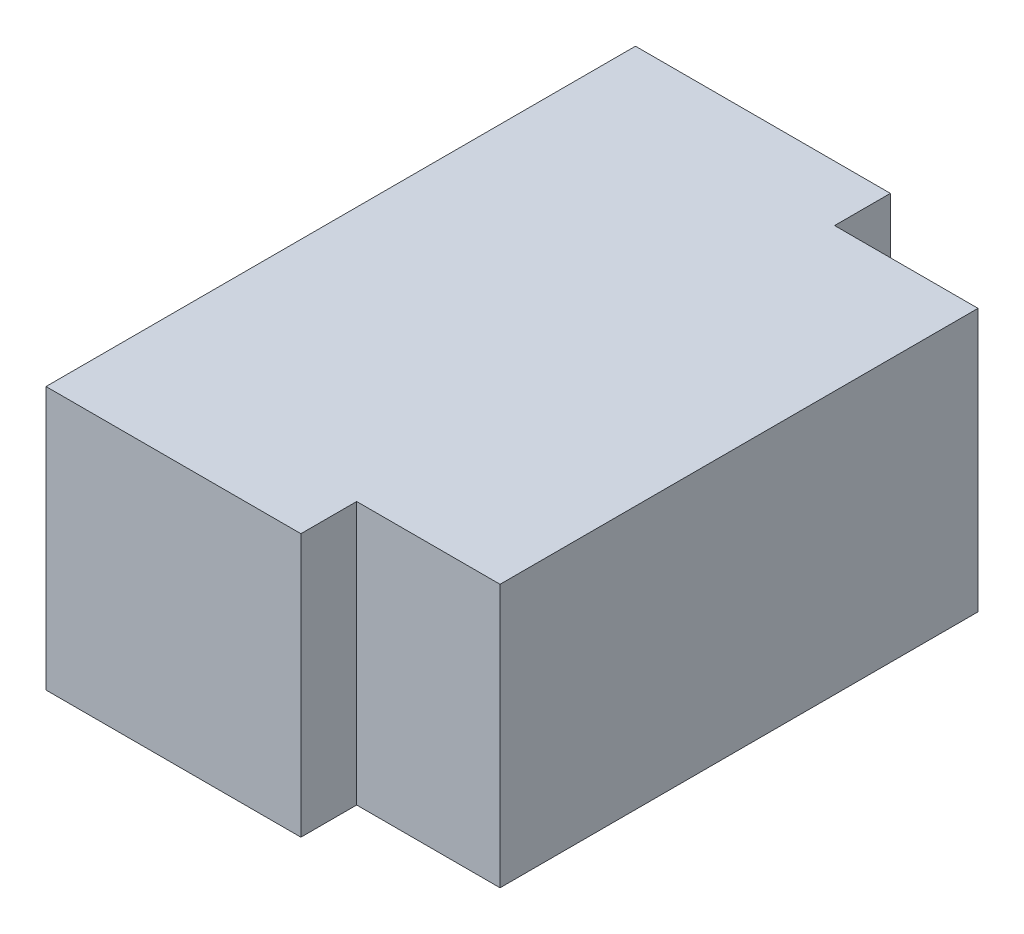
from build123d import *

# Parameters (mm, degrees)
BOSS_EXTRU_1_DEPTH = 33


with BuildPart() as part:
    # Esquisse1 → Boss.-Extru.1 (new body)
    with BuildSketch(Plane(origin=(0, 0, 0), x_dir=(1, 0, 0), z_dir=(0, 1, 0))):
        Polygon((8.388206388, 24.250614251), (26.388206388, 24.250614251), (26.388206388, -35.749385749), (8.388206388, -35.749385749), (8.388206388, -42.749385749), (-23.611793612, -42.749385749), (-23.611793612, -35.749385749), (-23.611793612, 24.250614251), (-23.611793612, 31.250614251), (8.388206388, 31.250614251), align=None)
    extrude(amount=BOSS_EXTRU_1_DEPTH)


solid = part.part
